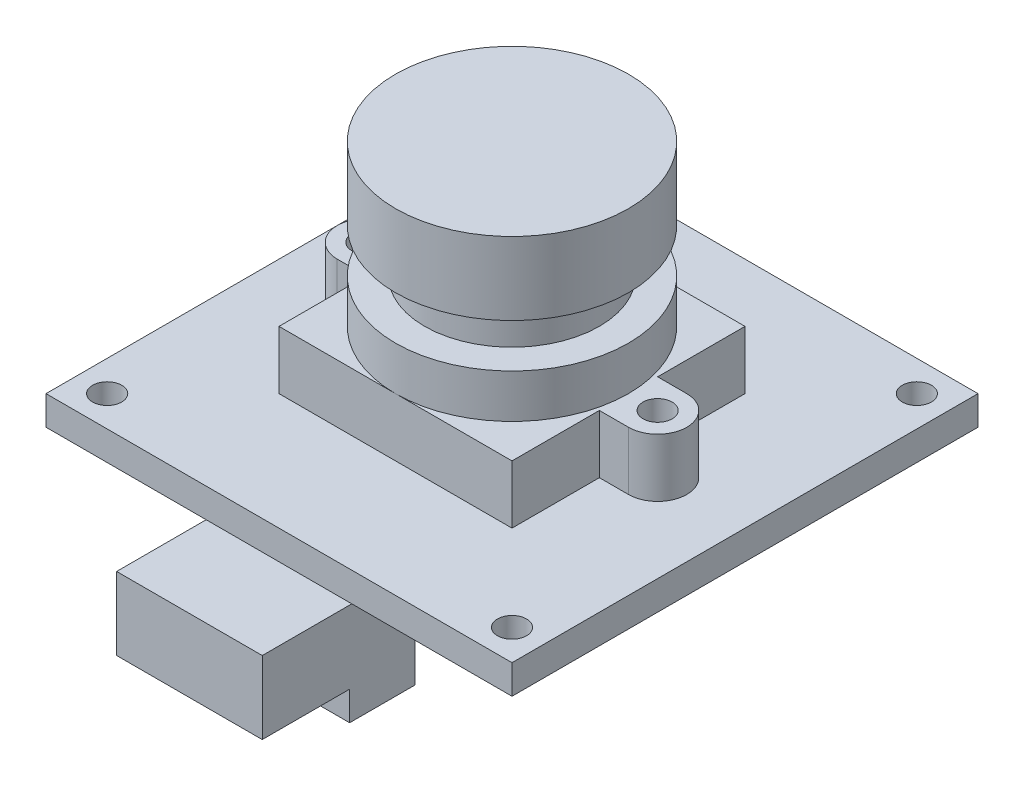
from build123d import *

# Parameters (mm, degrees)
SKETCH1_W           = 32
SKETCH1_H           = 32
SKETCH1_R           = 1
BOSS_EXTRUDE1_DEPTH = 2
SKETCH2_R           = 1
BOSS_EXTRUDE2_DEPTH = 4
SKETCH3_R           = 8
BOSS_EXTRUDE3_DEPTH = 3
SKETCH4_R           = 6
BOSS_EXTRUDE4_DEPTH = 3
SKETCH5_R           = 8
BOSS_EXTRUDE5_DEPTH = 5
SKETCH_1_W          = 10
SKETCH_1_H          = 4.5
EXTRUDE_1_DEPTH     = 7
SKETCH_2_W          = 10
SKETCH_2_H          = 5
EXTRUDE_2_DEPTH     = 6


with BuildPart() as part:
    # Sketch1 → Boss-Extrude1 (new body)
    with BuildSketch(Plane(origin=(0, 0, 0), x_dir=(1, 0, 0), z_dir=(0, 1, 0))):
        Rectangle(SKETCH1_W, SKETCH1_H)
        with Locations(Location((-13.9, 13.9, 0), (0, 0, 270))):
            Circle(SKETCH1_R, mode=Mode.SUBTRACT)
        with Locations(Location((13.9, 13.9, 0), (0, 0, 270))):
            Circle(SKETCH1_R, mode=Mode.SUBTRACT)
        with Locations(Location((-13.9, -13.9, 0), (0, 0, 270))):
            Circle(SKETCH1_R, mode=Mode.SUBTRACT)
        with Locations(Location((13.9, -13.9, 0), (0, 0, 270))):
            Circle(SKETCH1_R, mode=Mode.SUBTRACT)
    extrude(amount=BOSS_EXTRUDE1_DEPTH)

    # Sketch2 → Boss-Extrude2 (add)
    with BuildSketch(Plane(origin=(0, 2, 0), x_dir=(1, 0, 0), z_dir=(0, 1, 0))):
        with BuildLine():
            Line((-8, -8), (8, -8))
            Line((8, -8), (8, -2))
            Line((8, -2), (10, -2))
            ThreePointArc((10, -2), (12, 0), (10, 2))
            Line((10, 2), (8, 2))
            Line((8, 2), (8, 8))
            Line((8, 8), (-8, 8))
            Line((-8, 8), (-8, 2))
            Line((-8, 2), (-10, 2))
            ThreePointArc((-10, 2), (-12, 0), (-10, -2))
            Line((-10, -2), (-8, -2))
            Line((-8, -2), (-8, -8))
        make_face()
        with Locations(Location((10, 0, 0), (0, 0, 270))):
            Circle(SKETCH2_R, mode=Mode.SUBTRACT)
        with Locations(Location((-10, 0, 0), (0, 0, 270))):
            Circle(SKETCH2_R, mode=Mode.SUBTRACT)
    extrude(amount=BOSS_EXTRUDE2_DEPTH)

    # Sketch3 → Boss-Extrude3 (add)
    with BuildSketch(Plane(origin=(0, 6, 0), x_dir=(1, 0, 0), z_dir=(0, 1, 0))):
        with Locations(Location((0, 0, 0), (0, 0, 270))):
            Circle(SKETCH3_R)
    extrude(amount=BOSS_EXTRUDE3_DEPTH)

    # Sketch4 → Boss-Extrude4 (add)
    with BuildSketch(Plane(origin=(0, 9, 0), x_dir=(1, 0, 0), z_dir=(0, 1, 0))):
        with Locations(Location((0, 0, 0), (0, 0, 270))):
            Circle(SKETCH4_R)
    extrude(amount=BOSS_EXTRUDE4_DEPTH)

    # Sketch5 → Boss-Extrude5 (add)
    with BuildSketch(Plane(origin=(0, 12, 0), x_dir=(1, 0, 0), z_dir=(0, 1, 0))):
        with Locations(Location((0, 0, 0), (0, 0, 270))):
            Circle(SKETCH5_R)
    extrude(amount=BOSS_EXTRUDE5_DEPTH)

    # 草图1 → 凸台-拉伸1 (add)
    with BuildSketch(Plane.XZ):
        with Locations((0, 13.9)):
            Rectangle(SKETCH_1_W, SKETCH_1_H)
    extrude(amount=EXTRUDE_1_DEPTH)

    # 草图2 → 凸台-拉伸2 (add)
    with BuildSketch(Plane.XY.offset(16.15)):
        with Locations((0, -2.5)):
            Rectangle(SKETCH_2_W, SKETCH_2_H)
    extrude(amount=EXTRUDE_2_DEPTH)


solid = part.part
